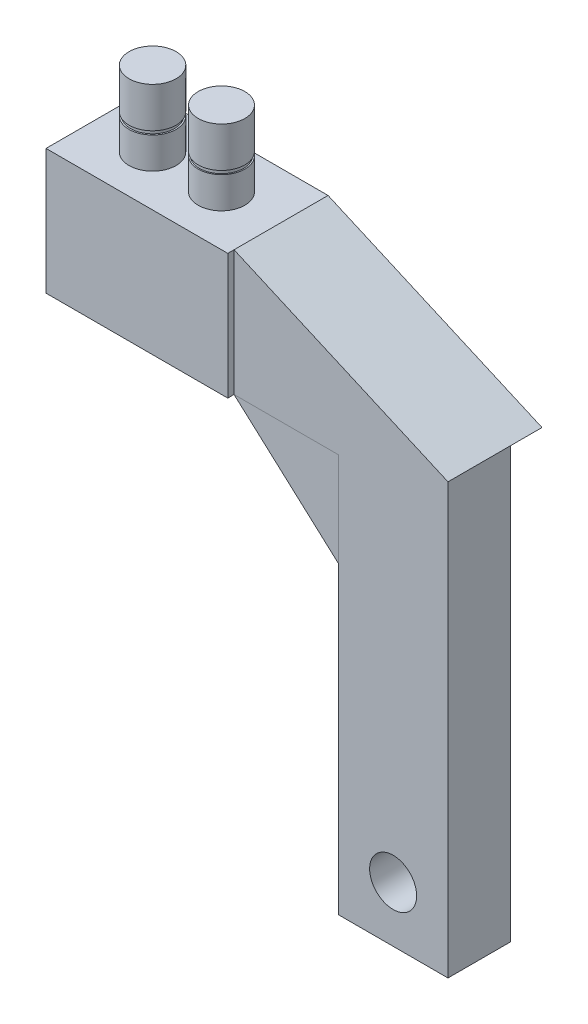
from build123d import *

# Parameters (mm, degrees)
SKETCH1_W            = 36.83
SKETCH1_H            = 20.32
BOSS_EXTRUDE1_DEPTH  = 25.4
SKETCH2_W            = 12.7
SKETCH2_H            = 6.35
BOSS_EXTRUDE2_DEPTH  = 43.344230304
SKETCH3_W            = 22.225
SKETCH3_H            = 12.7
BOSS_EXTRUDE3_DEPTH  = 80.713490592
SKETCH4_R            = 4.7625
CUT_EXTRUDE1_DEPTH   = 125.246440244
SKETCH5_R            = 4.7625
SKETCH5_R_2          = 4.729383401
BOSS_EXTRUDE4_DEPTH  = 15.24
BOSS_EXTRUDE5_DEPTH  = 20.32
SKETCH8_W            = 43.344230304
SKETCH8_H            = 1.27
CUT_EXTRUDE2_DEPTH   = 108.226300513
BOSS_EXTRUDE10_DEPTH = 20.32
F_3DSKETCH3_R        = 5.08
CUT_EXTRUDE4_DEPTH   = 0.7366
SKETCH14_R           = 4.4704
BOSS_EXTRUDE11_DEPTH = 0.7366


with BuildPart() as part:
    # Sketch1 → Boss-Extrude1 (new body)
    with BuildSketch(Plane(origin=(0, 0, 0), x_dir=(1, 0, 0), z_dir=(0, 1, 0))):
        Rectangle(SKETCH1_W, SKETCH1_H)
    extrude(amount=-BOSS_EXTRUDE1_DEPTH)

    # Sketch2 → Boss-Extrude2 (add)
    with BuildSketch(Plane(origin=(18.415, 0, 0), x_dir=(0, 0, -1), z_dir=(1, 0, 0))):
        with Locations((-2.54, -22.225)):
            Rectangle(SKETCH2_W, SKETCH2_H)
    extrude(amount=BOSS_EXTRUDE2_DEPTH)

    # Sketch3 → Boss-Extrude3 (add)
    with BuildSketch(Plane(origin=(0, -25.4, 0), x_dir=(-1, 0, 0), z_dir=(0, -1, 0))):
        with Locations((-50.646730304, -2.54)):
            Rectangle(SKETCH3_W, SKETCH3_H)
    extrude(amount=BOSS_EXTRUDE3_DEPTH)

    # Sketch4 → Cut-Extrude1 (cut, through all)
    with BuildSketch(Plane.XY.offset(8.89)):
        with Locations((50.646730304, -94.884200122)):
            Circle(SKETCH4_R)
    extrude(amount=-CUT_EXTRUDE1_DEPTH, mode=Mode.SUBTRACT)

    # Sketch5 → Boss-Extrude4 (add)
    with BuildSketch(Plane(origin=(0, 0, 0), x_dir=(1, 0, 0), z_dir=(0, 1, 0))):
        with Locations(Location((-6.985, 0, 0), (0, 0, 90))):
            Circle(SKETCH5_R)
        with Locations(Location((6.985, 0, 0), (0, 0, 90))):
            Circle(SKETCH5_R_2)
    extrude(amount=BOSS_EXTRUDE4_DEPTH)

    # Sketch7 → Boss-Extrude5 (add)
    with BuildSketch(Plane.XY.offset(10.16)):
        Polygon((18.415, 0), (61.759230304, -19.05), (18.415, -19.05), align=None)
    extrude(amount=-BOSS_EXTRUDE5_DEPTH)

    # Sketch8 → Cut-Extrude2 (cut, through all)
    with BuildSketch(Plane(origin=(0, -19.05, 0), x_dir=(-1, 0, 0), z_dir=(0, -1, 0))):
        with Locations((-40.087115152, -9.525)):
            Rectangle(SKETCH8_W, SKETCH8_H)
    extrude(amount=-CUT_EXTRUDE2_DEPTH, mode=Mode.SUBTRACT)

    # 3DSketch3 → Cut-Extrude4 (cut)
    with BuildSketch(Plane(origin=(-6.985, 6.35, 0), x_dir=(1, 0, 0), z_dir=(0, -1, 0))):
        Circle(F_3DSKETCH3_R)
        with Locations((13.97, 0)):
            Circle(F_3DSKETCH3_R)
    extrude(amount=-CUT_EXTRUDE4_DEPTH, mode=Mode.SUBTRACT)


with BuildPart() as body_2:
    # Sketch13 → Boss-Extrude10 (new body)
    with BuildSketch(Plane.XY.offset(8.89)):
        Polygon((18.415, -25.4), (39.534230304, -25.4), (39.534230304, -44.45), align=None)
    extrude(amount=-BOSS_EXTRUDE10_DEPTH)


with BuildPart() as cut_extrude4_piece_1:
    # of the separate pieces the step leaves, piece 1, a body of its own (cut_extrude4_pieces)
    add(part.part.solids().sort_by_distance((18.415, 0, 10.16))[0])



with BuildPart() as cut_extrude4_piece_2:
    # of the separate pieces the step leaves, piece 2, a body of its own (cut_extrude4_pieces)
    add(part.part.solids().sort_by_distance((-6.985, 7.0866, -4.7625))[0])


with BuildPart() as cut_extrude4_piece_3:
    # of the separate pieces the step leaves, piece 3, a body of its own (cut_extrude4_pieces)
    add(part.part.solids().sort_by_distance((6.985, 7.0866, -4.729383401))[0])


with BuildPart() as cut_extrude4_piece_1_1:
    add(cut_extrude4_piece_1.part)

    add(cut_extrude4_piece_2.part)  # Boss-Extrude11 merges Cut-Extrude4 piece 2

    add(cut_extrude4_piece_3.part)  # Boss-Extrude11 merges Cut-Extrude4 piece 3
    # Sketch14 → Boss-Extrude11 (add)
    with BuildSketch(Plane(origin=(0, 6.35, 0), x_dir=(1, 0, 0), z_dir=(0, 1, 0))):
        with Locations(Location((-6.985, 0, 0), (0, 0, 270))):
            Circle(SKETCH14_R)
        with Locations(Location((6.985, 0, 0), (0, 0, 270))):
            Circle(SKETCH14_R)
    extrude(amount=BOSS_EXTRUDE11_DEPTH)


solid = Compound([body_2.part, cut_extrude4_piece_1_1.part])
